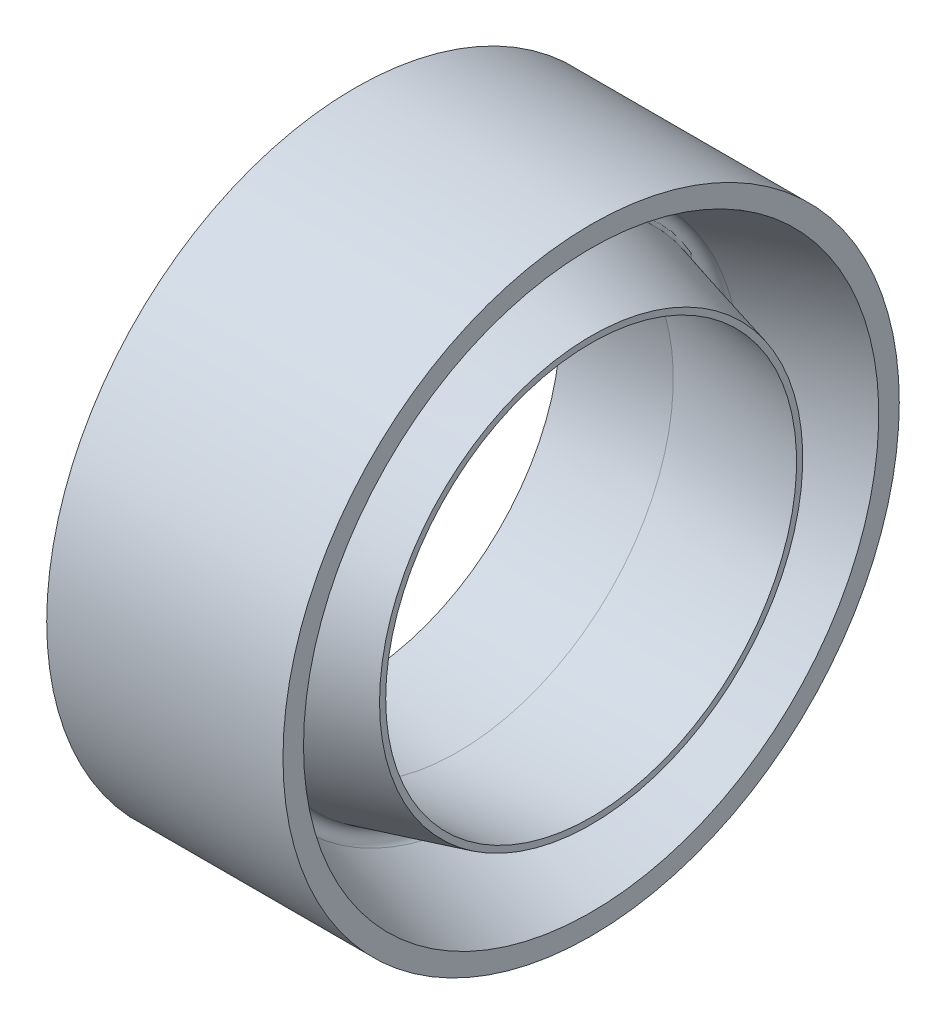
from build123d import *


with BuildPart() as part:
    # Szkic1 → Obrót1 (revolve)
    with BuildSketch(Plane.XY, mode=Mode.PRIVATE) as obr_t1_sk:
        with BuildLine():
            Line((-30.5, 15.342508556), (-42, 15.342508556))
            Line((-42, 15.342508556), (-42, 11.842508556))
            Line((-42, 11.842508556), (-39.351466792, 11.842508556))
            ThreePointArc((-39.351466792, 11.842508556), (-39.253071436, 11.760351037), (-39.316354447, 11.648875638))
            Line((-39.316354447, 11.648875638), (-42, 10.642508556))
            Line((-42, 10.642508556), (-42, 10.342508556))
            Line((-42, 10.342508556), (-37, 10.842508556))
            Line((-37, 10.842508556), (-30.5, 10.342508556))
            Line((-30.5, 10.342508556), (-30.5, 10.642508556))
            Line((-30.5, 10.642508556), (-35.639658009, 11.986726805))
            ThreePointArc((-35.639658009, 11.986726805), (-35.938355792, 12.365172989), (-35.656081251, 12.756022017))
            Line((-35.656081251, 12.756022017), (-30.5, 14.342508556))
            Line((-30.5, 14.342508556), (-30.5, 15.342508556))
        make_face()
    revolve(obr_t1_sk.sketch.rotate(Axis((-61.483966901, 0.342508556, 0), (1, 0, 0)), 90), axis=Axis((-61.483966901, 0.342508556, 0), (1, 0, 0)))


solid = part.part
